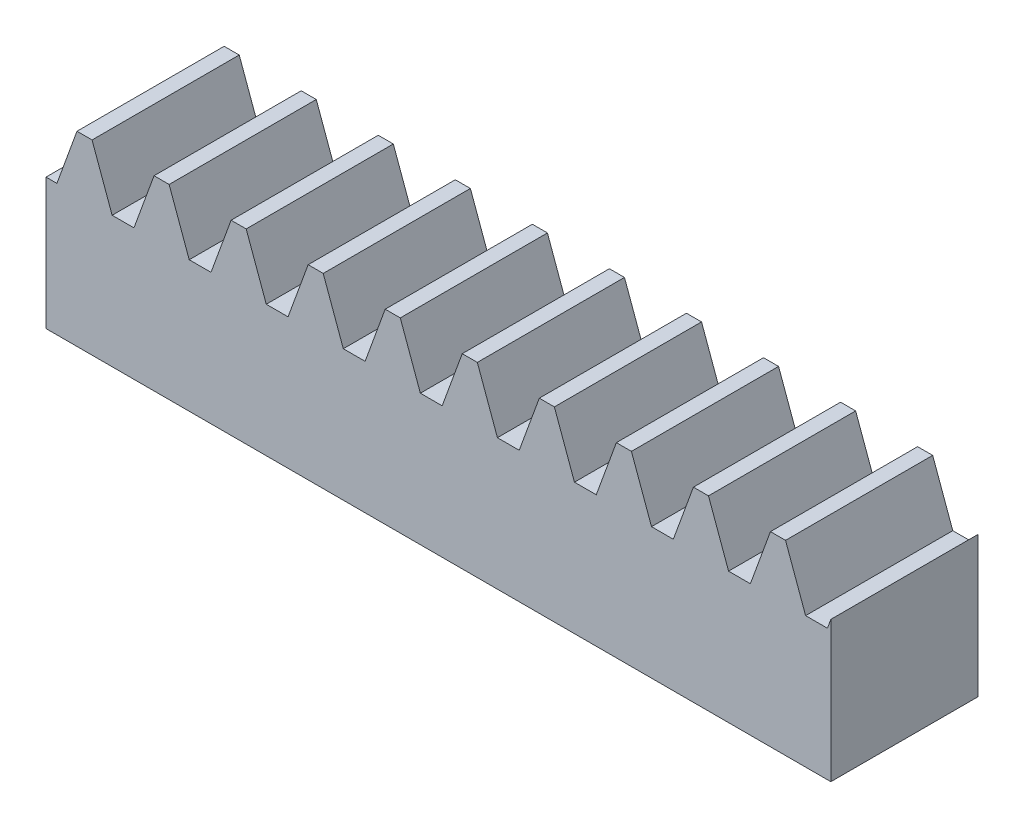
from build123d import *

# Parameters (mm, degrees)
BLANKSKE_W        = 16
BLANKSKE_H        = 3.8
BLANK_DEPTH       = 3
TOOTHCUTSIM_DEPTH = 17.716458955
TEETHCUTS_COUNT   = 11
TEETHCUTS_PITCH   = 1.570796325


with BuildPart() as part:
    # BlankSke → Blank (new body)
    with BuildSketch(Plane.XY):
        with Locations((8, 1.9)):
            Rectangle(BLANKSKE_W, BLANKSKE_H)
    extrude(amount=-BLANK_DEPTH)

    # TooCutSkeSim → ToothCutSim (cut, through all)
    with BuildSketch(Plane.XY):
        Polygon((0.222217685, 2.675), (-0.222217685, 2.675), (-0.640929042, 3.8254), (0.640929042, 3.8254), align=None)
    toothcutsim = extrude(amount=-TOOTHCUTSIM_DEPTH, mode=Mode.SUBTRACT)

    # TeethCuts: ToothCutSim ×11
    with Locations(*[(i * TEETHCUTS_PITCH, 0, 0) for i in range(1, TEETHCUTS_COUNT)]):
        add(toothcutsim, mode=Mode.SUBTRACT)


solid = part.part
